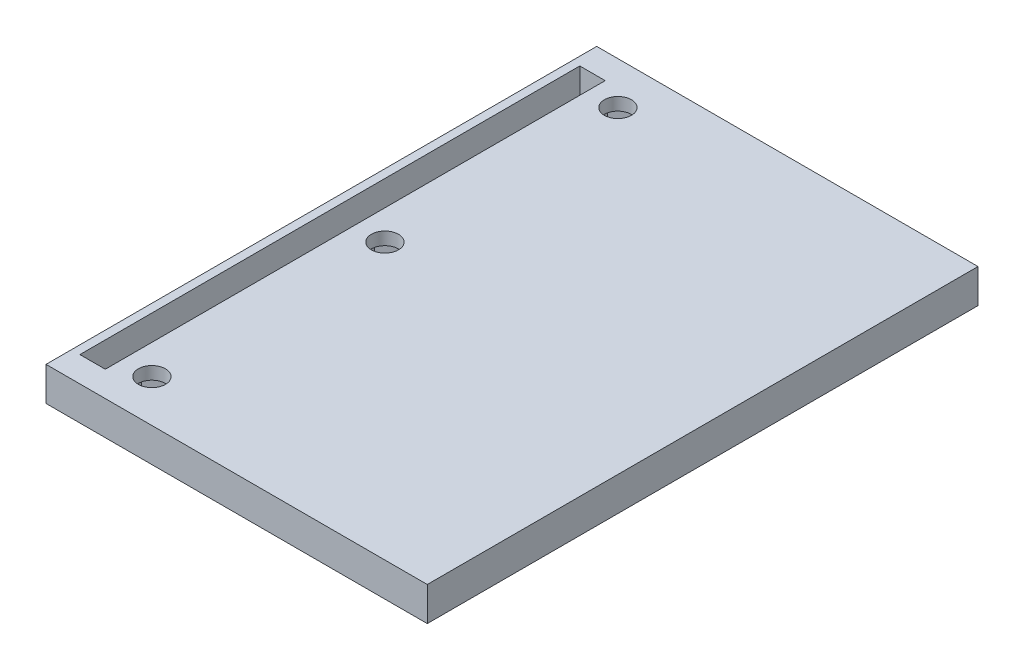
from build123d import *

# Parameters (mm, degrees)
SKETCH1_W           = 45
SKETCH1_H           = 65
SKETCH1_R           = 1.6
SKETCH1_W_2         = 3
SKETCH1_H_2         = 59
BOSS_EXTRUDE1_DEPTH = 2
CUT_EXTRUDE1_DEPTH  = 2.5


with BuildPart() as part:
    # Sketch1 → Boss-Extrude1 (new, symmetric)
    with BuildSketch(Plane(origin=(0, 0, 0), x_dir=(1, 0, 0), z_dir=(0, 1, 0))):
        Rectangle(SKETCH1_W, SKETCH1_H)
        with Locations(Location((-15, 27.5, 0), (0, 0, 270))):
            Circle(SKETCH1_R, mode=Mode.SUBTRACT)
        with Locations(Location((-15, 0, 0), (0, 0, 270))):
            Circle(SKETCH1_R, mode=Mode.SUBTRACT)
        with Locations(Location((-15, -27.5, 0), (0, 0, 90))):
            Circle(SKETCH1_R, mode=Mode.SUBTRACT)
        with Locations((-20, 0)):
            Rectangle(SKETCH1_W_2, SKETCH1_H_2, mode=Mode.SUBTRACT)
    extrude(amount=BOSS_EXTRUDE1_DEPTH, both=True)

    # Sketch4 → Cut-Extrude1 (cut)
    with BuildSketch(Plane.XZ.offset(2)):
        Polygon((-15, -3.319764048), (-12.125, -1.659882024), (-12.125, 1.659882024), (-15, 3.319764048), (-17.875, 1.659882024), (-17.875, -1.659882024), align=None)
        Polygon((-17.875, -25.840117976), (-15, -24.180235952), (-12.125, -25.840117976), (-12.125, -29.159882024), (-15, -30.819764048), (-17.875, -29.159882024), align=None)
        Polygon((-15, 24.180235952), (-12.125, 25.840117976), (-12.125, 29.159882024), (-15, 30.819764048), (-17.875, 29.159882024), (-17.875, 25.840117976), align=None)
    extrude(amount=-CUT_EXTRUDE1_DEPTH, mode=Mode.SUBTRACT)


solid = part.part
